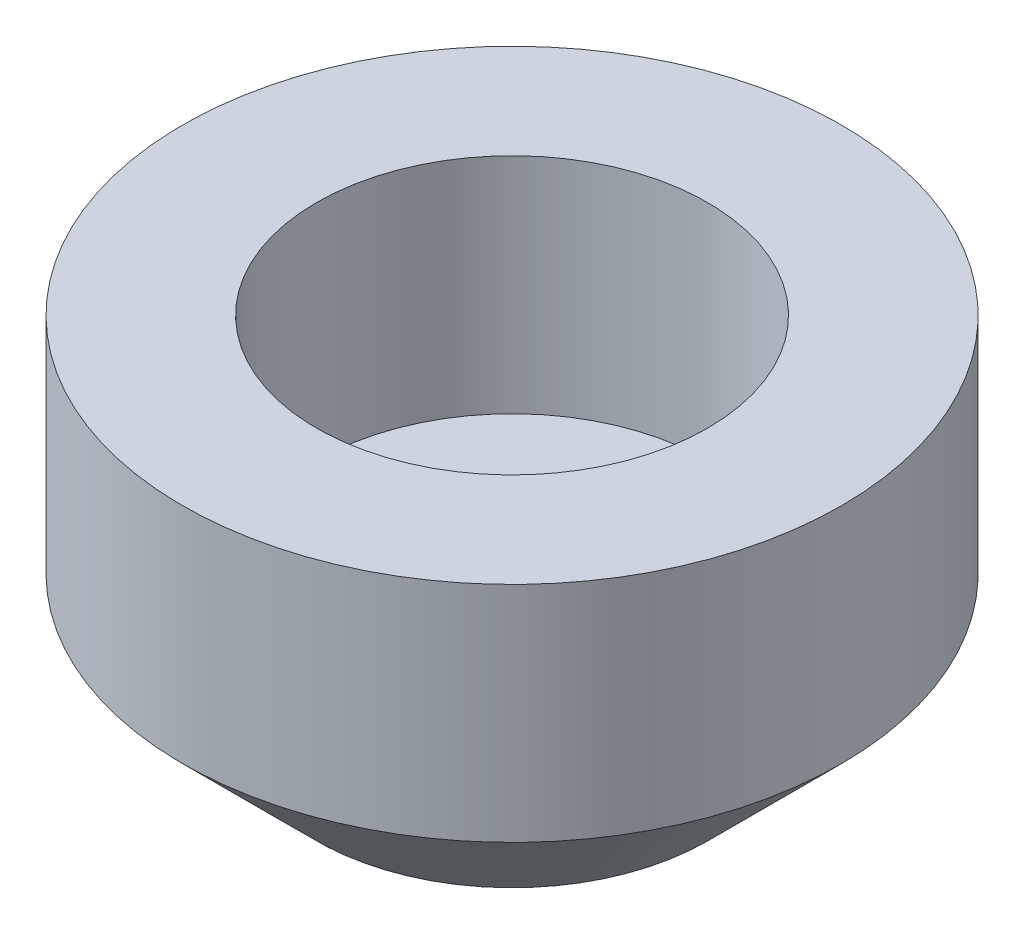
from build123d import *


with BuildPart() as part:
    # Sketch1 → Revolve1 (revolve)
    with BuildSketch(Plane.XY, mode=Mode.PRIVATE) as revolve1_sk:
        Polygon((0, 0), (-4.375, 0), (-4.375, 5), (-7.375, 5), (-7.375, 0), (-4.375, -3), (0, -3), align=None)
    revolve(revolve1_sk.sketch.rotate(Axis((0, -3, 0), (0, 1, 0)), 180), axis=Axis((0, -3, 0), (0, 1, 0)))


solid = part.part
